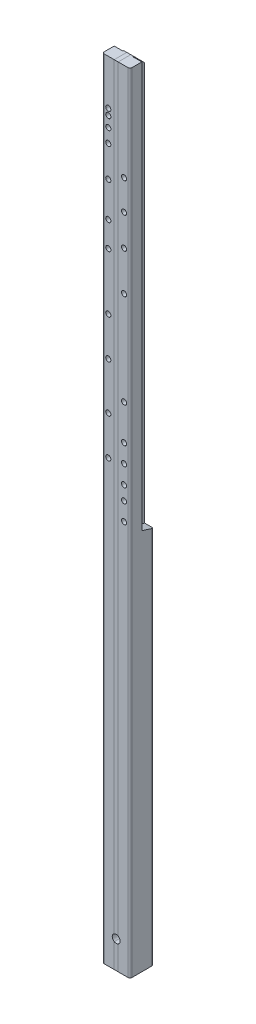
from build123d import *

# Parameters (mm, degrees)
SKETCH1_W           = 38.1
SKETCH1_H           = 1270
BOSS_EXTRUDE1_DEPTH = 3.175
SKETCH8_W           = 38.1
SKETCH8_H           = 1270
BOSS_EXTRUDE2_DEPTH = 19.05
CUT_EXTRUDE6_DEPTH  = 14.2875
FILLET1_R           = 3.175
CHAMFER1_SIZE       = 17.78
CHAMFER2_SIZE       = 17.78
SKETCH2_R           = 6.35
CUT_EXTRUDE1_DEPTH  = 637.530094045
SKETCH5_R           = 1.905
CUT_EXTRUDE3_DEPTH  = 637.530094045
SKETCH6_R           = 4.1275
CUT_EXTRUDE4_DEPTH  = 7.747


with BuildPart() as part:
    # Sketch1 → Boss-Extrude1 (new, symmetric)
    with BuildSketch(Plane(origin=(0, 0, 0), x_dir=(0, 0, -1), z_dir=(1, 0, 0))):
        Rectangle(SKETCH1_W, SKETCH1_H)
    extrude(amount=BOSS_EXTRUDE1_DEPTH, both=True)

    # Chamfer2
    chamfer2_edges = [part.edges().sort_by_distance(p)[0] for p in [
        (0, 635, -19.05),
    ]]
    chamfer(chamfer2_edges, length=CHAMFER2_SIZE)


with BuildPart() as body_2:
    # Sketch8 → Boss-Extrude2 (new body)
    with BuildSketch(Plane(origin=(3.175, 0, 0), x_dir=(0, 0, -1), z_dir=(1, 0, 0))):
        Rectangle(SKETCH8_W, SKETCH8_H)
    extrude(amount=BOSS_EXTRUDE2_DEPTH)

    # Sketch10 → Cut-Extrude6 (cut)
    with BuildSketch(Plane(origin=(22.225, 0, 0), x_dir=(0, 0, -1), z_dir=(1, 0, 0))):
        Polygon((19.05, 635), (0, 635), (0, -19.210279787), (19.05, -25.4), align=None)
    extrude(amount=-CUT_EXTRUDE6_DEPTH, mode=Mode.SUBTRACT)

    # Fillet1
    fillet1_edges = [body_2.edges().sort_by_distance(p)[0] for p in [
        (22.225, -330.2, -19.05),
        (22.225, 0, 19.05),
    ]]
    fillet(fillet1_edges, radius=FILLET1_R)

    # Chamfer1
    chamfer1_edges = [body_2.edges().sort_by_distance(p)[0] for p in [
        (5.55625, 635, -19.05),
    ]]
    chamfer(chamfer1_edges, length=CHAMFER1_SIZE)


with BuildPart() as body_3:
    # Mirror3: mirrored copy
    add(body_2.part.mirror(Plane(origin=(0, 0, 0), x_dir=(0, 0, 1), z_dir=(1, 0, 0))))


with BuildPart() as cut_extrude1_tool:
    # Sketch2 → Cut-Extrude1 (new, through all)
    with BuildSketch(Plane.XY.offset(19.05)):
        with Locations((0, -590.55)):
            Circle(SKETCH2_R)
    extrude(amount=-CUT_EXTRUDE1_DEPTH)


with BuildPart() as part_1:
    add(part.part)

    # Cut-Extrude1: cut by cut_extrude1_tool
    add(cut_extrude1_tool.part, mode=Mode.SUBTRACT)


with BuildPart() as body_2_1:
    add(body_2.part)

    # Cut-Extrude1: cut by cut_extrude1_tool
    add(cut_extrude1_tool.part, mode=Mode.SUBTRACT)


with BuildPart() as body_3_1:
    add(body_3.part)

    # Cut-Extrude1: cut by cut_extrude1_tool
    add(cut_extrude1_tool.part, mode=Mode.SUBTRACT)


with BuildPart() as cut_extrude3_tool:
    # Sketch5 → Cut-Extrude3 (new, through all)
    with BuildSketch(Plane.XY.offset(19.05)):
        with Locations((-12.7, 513.302135886)):
            Circle(SKETCH5_R)
        with Locations((12.7, 478.263647874)):
            Circle(SKETCH5_R)
        with Locations((-12.7, 463.345550332)):
            Circle(SKETCH5_R)
        with Locations((12.7, 430.113859098)):
            Circle(SKETCH5_R)
        with Locations((-12.7, 407.064148942)):
            Circle(SKETCH5_R)
        with Locations((12.7, 379.842698104)):
            Circle(SKETCH5_R)
        with Locations((-12.7, 366.551491472)):
            Circle(SKETCH5_R)
        with Locations((12.7, 316.418969048)):
            Circle(SKETCH5_R)
        with Locations((-12.7, 535.422112699)):
            Circle(SKETCH5_R)
        with Locations((-12.7, 552.28498253)):
            Circle(SKETCH5_R)
        with Locations((-12.7, 562.430692594)):
            Circle(SKETCH5_R)
        with Locations((12.7, 165.149796436)):
            Circle(SKETCH5_R)
        with Locations((12.7, 108.45633512)):
            Circle(SKETCH5_R)
        with Locations((12.7, 79.058526758)):
            Circle(SKETCH5_R)
        with Locations((12.7, 49.653866377)):
            Circle(SKETCH5_R)
        with Locations((12.7, 27.043187605)):
            Circle(SKETCH5_R)
        with Locations((12.7, -1.905)):
            Circle(SKETCH5_R)
        with Locations((-12.7, 74.386924519)):
            Circle(SKETCH5_R)
        with Locations((-12.7, 137.013245544)):
            Circle(SKETCH5_R)
        with Locations((-12.7, 212.596714918)):
            Circle(SKETCH5_R)
        with Locations((-12.7, 275.179690854)):
            Circle(SKETCH5_R)
    extrude(amount=-CUT_EXTRUDE3_DEPTH)


with BuildPart() as body_2_2:
    add(body_2_1.part)

    # Cut-Extrude3: cut by cut_extrude3_tool
    add(cut_extrude3_tool.part, mode=Mode.SUBTRACT)


with BuildPart() as body_3_2:
    add(body_3_1.part)

    # Cut-Extrude3: cut by cut_extrude3_tool
    add(cut_extrude3_tool.part, mode=Mode.SUBTRACT)


with BuildPart() as cut_extrude4_tool:
    # Sketch6 → Cut-Extrude4 (new body)
    with BuildSketch(Plane.XY.offset(19.05)):
        with Locations((-12.7, 513.302135886)):
            Circle(SKETCH6_R)
        with Locations((12.7, 478.263647874)):
            Circle(SKETCH6_R)
        with Locations((-12.7, 463.345550332)):
            Circle(SKETCH6_R)
        with Locations((12.7, 430.113859098)):
            Circle(SKETCH6_R)
        with Locations((12.7, 379.842698104)):
            Circle(SKETCH6_R)
        with Locations((12.7, 316.418969048)):
            Circle(SKETCH6_R)
        with Locations((-12.7, 366.551491472)):
            Circle(SKETCH6_R)
        with Locations((-12.7, 407.064148942)):
            Circle(SKETCH6_R)
        with Locations((-12.7, 562.430692594)):
            Circle(SKETCH6_R)
        with Locations((-12.7, 552.28498253)):
            Circle(SKETCH6_R)
        with Locations((-12.7, 535.422112699)):
            Circle(SKETCH6_R)
        with Locations((-12.7, 275.179690854)):
            Circle(SKETCH6_R)
        with Locations((-12.7, 212.596714918)):
            Circle(SKETCH6_R)
        with Locations((12.7, 165.149796436)):
            Circle(SKETCH6_R)
        with Locations((-12.7, 137.013245544)):
            Circle(SKETCH6_R)
        with Locations((12.7, 108.45633512)):
            Circle(SKETCH6_R)
        with Locations((12.7, 79.058526758)):
            Circle(SKETCH6_R)
        with Locations((-12.7, 74.386924519)):
            Circle(SKETCH6_R)
        with Locations((12.7, 49.653866377)):
            Circle(SKETCH6_R)
        with Locations((12.7, 27.043187605)):
            Circle(SKETCH6_R)
        with Locations((12.7, -1.905)):
            Circle(SKETCH6_R)
    extrude(amount=-CUT_EXTRUDE4_DEPTH)


with BuildPart() as body_2_3:
    add(body_2_2.part)

    # Cut-Extrude4: cut by cut_extrude4_tool
    add(cut_extrude4_tool.part, mode=Mode.SUBTRACT)


with BuildPart() as body_3_3:
    add(body_3_2.part)

    # Cut-Extrude4: cut by cut_extrude4_tool
    add(cut_extrude4_tool.part, mode=Mode.SUBTRACT)


solid = Compound([part_1.part, body_2_3.part, body_3_3.part])
